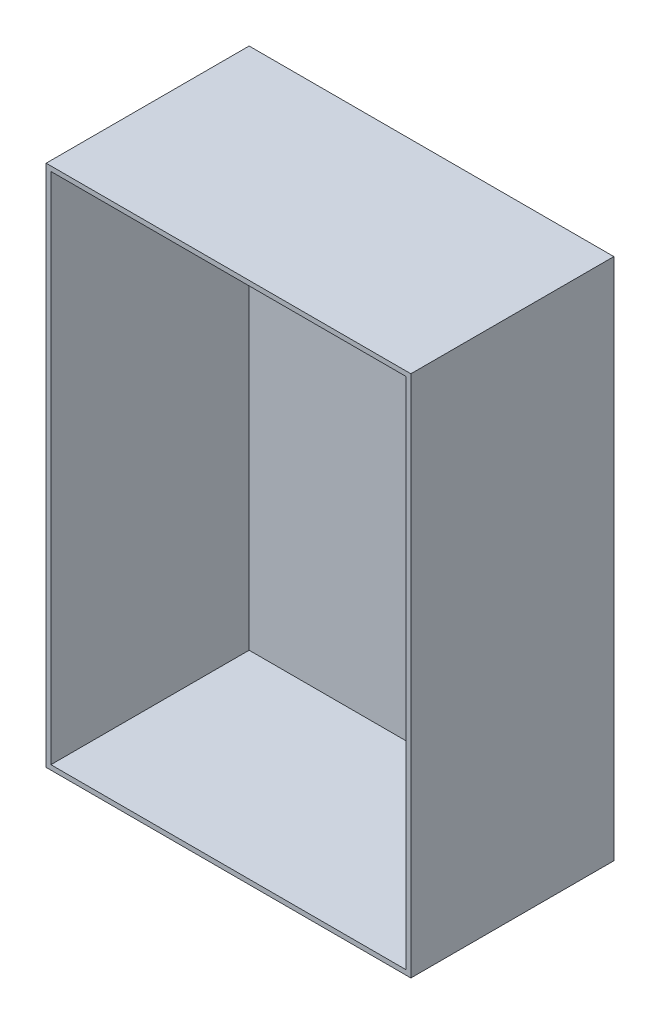
from build123d import *

# Parameters (mm, degrees)
SKETCH1_W     = 230
SKETCH1_H     = 330
SKETCH1_W_2   = 224
SKETCH1_H_2   = 324
PROFILE_DEPTH = 128
SKETCH2_W     = 224
SKETCH2_H     = 324
BACK_DEPTH    = 3


with BuildPart() as part:
    # Sketch1 → Profile (new body)
    with BuildSketch(Plane.XY):
        with Locations((115, 165)):
            Rectangle(SKETCH1_W, SKETCH1_H)
        with Locations((115, 165)):
            Rectangle(SKETCH1_W_2, SKETCH1_H_2, mode=Mode.SUBTRACT)
    extrude(amount=PROFILE_DEPTH)

    # Sketch2 → Back (add)
    with BuildSketch(Plane.XY):
        with Locations((115, 165)):
            Rectangle(SKETCH2_W, SKETCH2_H)
    extrude(amount=BACK_DEPTH)


solid = part.part
